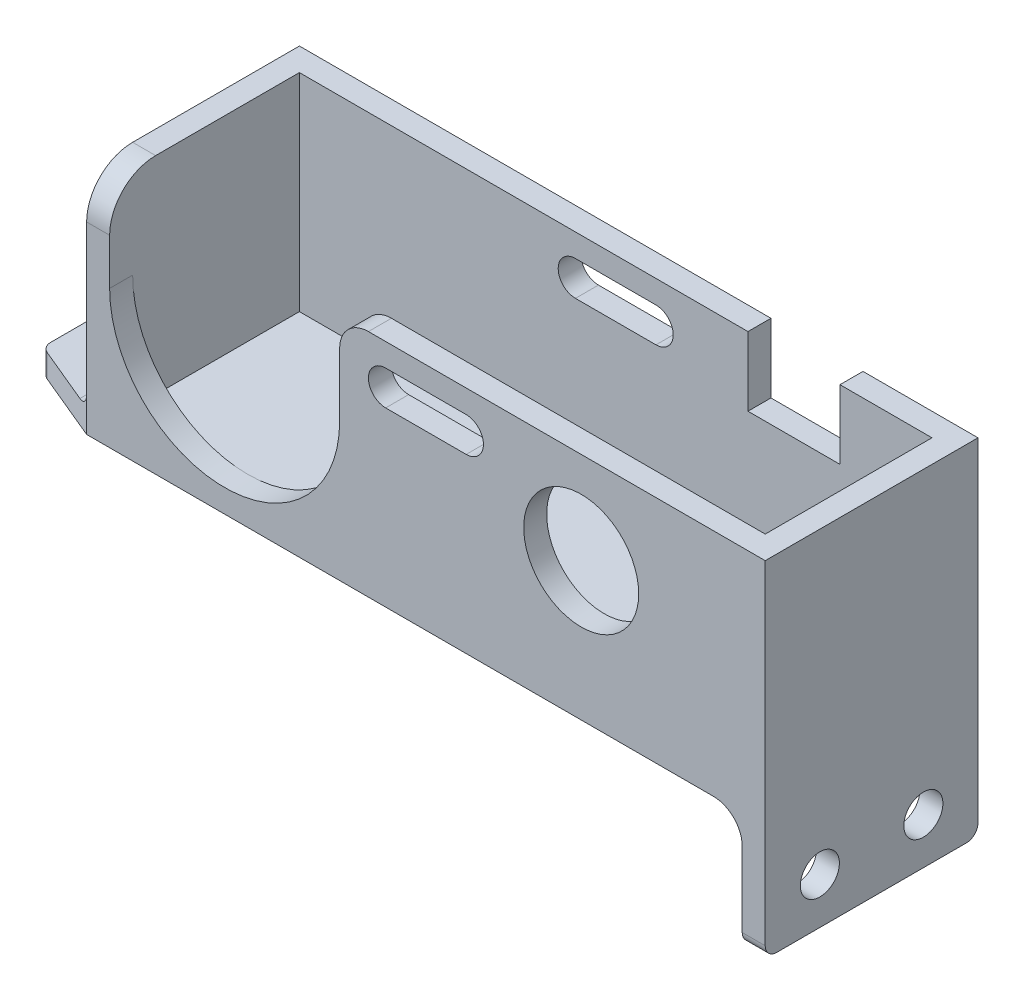
from build123d import *

# Parameters (mm, degrees)
SKETCH1_W               = 55
SKETCH1_H               = 18
BOSS_EXTRUDE1_DEPTH     = 7.25
SHELL2_T                = 2
LENS_CUTOUT_REACH       = 38.517
POWER_BUTTON_HOLE_REACH = 38.517
SKETCH12_R              = 5
POWER_CORD_CUTOUT_REACH = 38.517
SKETCH13_W              = 8
SKETCH13_H              = 6
CUT_EXTRUDE4_DEPTH      = 37.517119273
FILLET4_R               = 2.5
BOSS_EXTRUDE3_DEPTH     = 2
M3_CLEARANCE_HOLE1_D    = 3.4
FILLET2_R               = 1
SKETCH18_W              = 2
SKETCH18_H              = 18.5
BOSS_EXTRUDE4_DEPTH     = 10
M3_CLEARANCE_HOLE2_D    = 3.4
FILLET3_R               = 2.5
FILLET5_R               = 4
FILLET6_R               = 1


with BuildPart() as part:
    # Sketch1 → Boss-Extrude1 (new, symmetric)
    with BuildSketch(Plane.XY):
        Rectangle(SKETCH1_W, SKETCH1_H)
    extrude(amount=BOSS_EXTRUDE1_DEPTH, both=True)

    # Shell2
    shell2_openings = [part.faces().sort_by_distance(p)[0] for p in [
        (0, 9, 0),
    ]]
    offset(amount=SHELL2_T, openings=shell2_openings, kind=Kind.INTERSECTION)

    # Sketch11 → lens cutout (cut, up to next)
    with BuildSketch(Plane.XY.offset(9.25), mode=Mode.PRIVATE) as lens_cutout_sk1:
        with BuildLine():
            Line((-27.5, 9), (-27.5, 1))
            ThreePointArc((-27.5, 1), (-17.5, -9), (-7.5, 1))
            Line((-7.5, 1), (-7.5, 9))
            Line((-7.5, 9), (-27.5, 9))
        make_face()
    lens_cutout_tool1 = extrude(lens_cutout_sk1.sketch, amount=-LENS_CUTOUT_REACH, mode=Mode.PRIVATE) & part.part
    add(lens_cutout_tool1.solids().sort_by_distance((-17.5, 0.915899, 9.25))[0], mode=Mode.SUBTRACT)

    # Sketch12 → power button hole (cut, up to next)
    with BuildSketch(Plane.XY.offset(9.25), mode=Mode.PRIVATE) as power_button_hole_sk1:
        with Locations((13.5, 1)):
            Circle(SKETCH12_R)
    power_button_hole_tool1 = extrude(power_button_hole_sk1.sketch, amount=-POWER_BUTTON_HOLE_REACH, mode=Mode.PRIVATE) & part.part
    add(power_button_hole_tool1.solids().sort_by_distance((13.5, 1, 9.25))[0], mode=Mode.SUBTRACT)

    # Sketch13 → power cord cutout (cut, up to next)
    with BuildSketch(Plane(origin=(0, 0, -9.25), x_dir=(-1, 0, 0), z_dir=(0, 0, -1)), mode=Mode.PRIVATE) as power_cord_cutout_sk1:
        with Locations((-15.5, 6)):
            Rectangle(SKETCH13_W, SKETCH13_H)
    power_cord_cutout_tool1 = extrude(power_cord_cutout_sk1.sketch, amount=-POWER_CORD_CUTOUT_REACH, mode=Mode.PRIVATE) & part.part
    add(power_cord_cutout_tool1.solids().sort_by_distance((15.5, 6, -9.25))[0], mode=Mode.SUBTRACT)

    # Sketch21 → Cut-Extrude4 (cut, through all)
    with BuildSketch(Plane.XY.offset(9.25)):
        with BuildLine():
            Line((-3.5, 7), (3.5, 7))
            ThreePointArc((3.5, 7), (5, 5.5), (3.5, 4))
            Line((3.5, 4), (-3.5, 4))
            ThreePointArc((-3.5, 4), (-5, 5.5), (-3.5, 7))
        make_face()
    extrude(amount=-CUT_EXTRUDE4_DEPTH, mode=Mode.SUBTRACT)

    # Fillet4
    fillet4_edges = [part.edges().sort_by_distance(p)[0] for p in [
        (-7.5, 9, 8.25),
    ]]
    fillet(fillet4_edges, radius=FILLET4_R)

    # Sketch15 → Boss-Extrude3 (add)
    with BuildSketch(Plane.XZ.offset(11)):
        Polygon((-29.5, 9.25), (-29.5, -9.25), (-36, -11.96461114), (-36, 6.53538886), align=None)
    extrude(amount=-BOSS_EXTRUDE3_DEPTH)

    # M3 Clearance Hole1 (through all)
    with Locations(Plane(origin=(0, -9, 0), x_dir=(1, 0, 0), z_dir=(0, 1, 0))):
        with Locations((-32.75, 1.35730557)):
            Hole(M3_CLEARANCE_HOLE1_D / 2)

    # Fillet2
    fillet2_edges = [part.edges().sort_by_distance(p)[0] for p in [
        (-29.5, -9, 0),
    ]]
    fillet(fillet2_edges, radius=FILLET2_R)

    # Sketch18 → Boss-Extrude4 (add)
    with BuildSketch(Plane.XZ.offset(11)):
        with Locations((28.5, 0)):
            Rectangle(SKETCH18_W, SKETCH18_H)
    extrude(amount=BOSS_EXTRUDE4_DEPTH)

    # M3 Clearance Hole2 (through all)
    with Locations(Plane.ZY.offset(-27.5)):
        with Locations((-4.5, -17), (4.5, -17)):
            Hole(M3_CLEARANCE_HOLE2_D / 2)

    # Fillet3
    fillet3_edges = [part.edges().sort_by_distance(p)[0] for p in [
        (27.5, -11, 0),
    ]]
    fillet(fillet3_edges, radius=FILLET3_R)

    # Fillet5
    fillet5_edges = [part.edges().sort_by_distance(p)[0] for p in [
        (-28.5, 9, 9.25),
    ]]
    fillet(fillet5_edges, radius=FILLET5_R)

    # Fillet6
    fillet6_edges = [part.edges().sort_by_distance(p)[0] for p in [
        (-36, -10, 6.53538886),
        (-36, -10, -11.96461114),
        (28.5, -21, 9.25),
        (28.5, -21, -9.25),
    ]]
    fillet(fillet6_edges, radius=FILLET6_R)


solid = part.part
